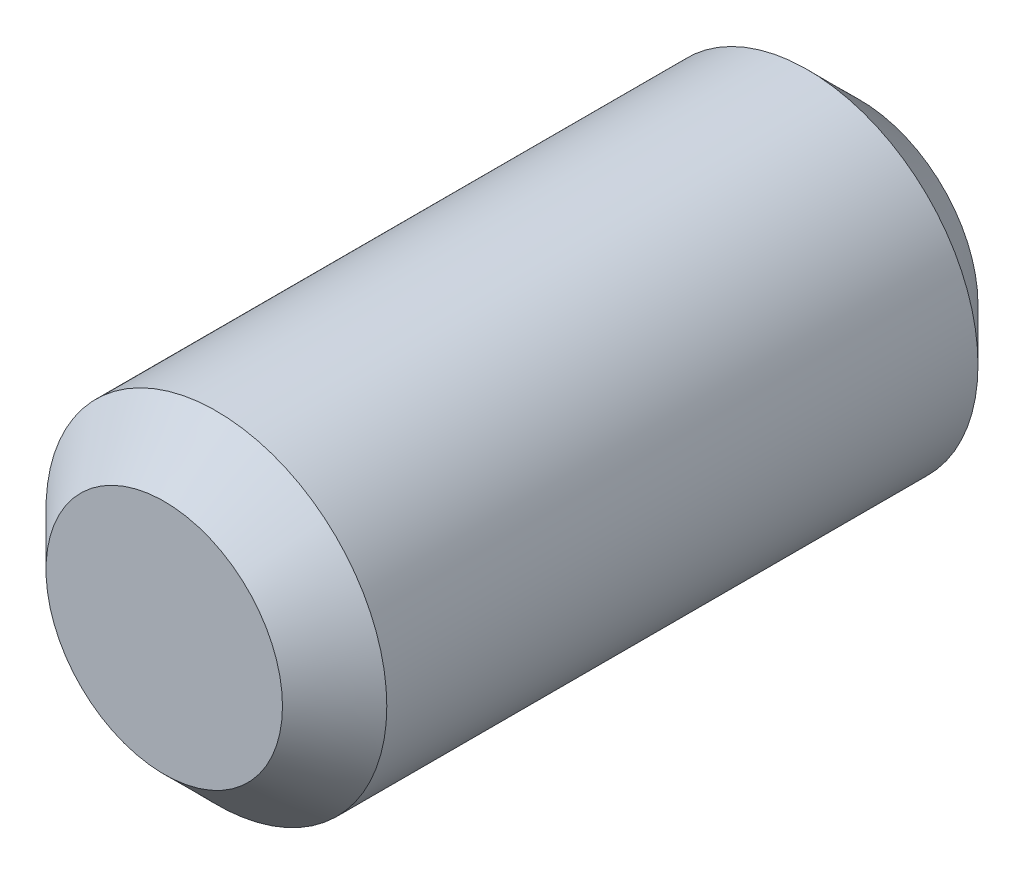
from build123d import *

# Parameters (mm, degrees)
SKETCH1_R           = 2.45
BOSS_EXTRUDE1_DEPTH = 10
FILLET1_SIZE        = 0.75


with BuildPart() as part:
    # Sketch1 → Boss-Extrude1 (new body)
    with BuildSketch(Plane.XY):
        Circle(SKETCH1_R)
    extrude(amount=BOSS_EXTRUDE1_DEPTH)

    # Fillet1
    fillet1_edges = [part.edges().sort_by_distance(p)[0] for p in [
        (-2.45, 0, 0),
        (-2.45, 0, 10),
    ]]
    chamfer(fillet1_edges, length=FILLET1_SIZE)


solid = part.part
